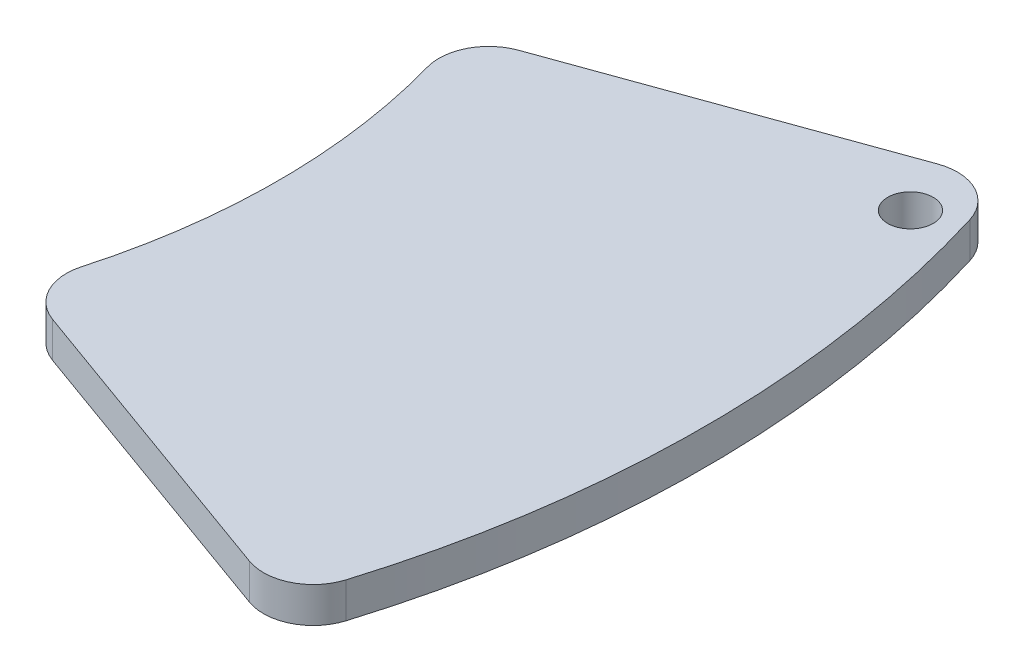
from build123d import *

# Parameters (mm, degrees)
BOSS_EXTRUDE1_DEPTH = 3.175
SKETCH2_R           = 2.032
CUT_EXTRUDE1_DEPTH  = 101.626437428
FILLET1_R           = 4.445


with BuildPart() as part:
    # Sketch1 → Boss-Extrude1 (new body)
    with BuildSketch(Plane(origin=(0, 0, 0), x_dir=(1, 0, 0), z_dir=(0, 1, 0))):
        with BuildLine():
            Line((53.764572514, 19.37764801), (89.607620856, 32.296080017))
            ThreePointArc((89.607620856, 32.296080017), (95.25, 0), (89.607620856, -32.296080017))
            Line((89.607620856, -32.296080017), (53.764572514, -19.37764801))
            ThreePointArc((53.764572514, -19.37764801), (57.15, 0), (53.764572514, 19.37764801))
        make_face()
    extrude(amount=BOSS_EXTRUDE1_DEPTH)

    # Sketch2 → Cut-Extrude1 (cut, through all)
    with BuildSketch(Plane(origin=(0, 3.175, 0), x_dir=(1, 0, 0), z_dir=(0, 1, 0))):
        with Locations(Location((87.702620856, 25.946080017, 0), (0, 0, 270))):
            Circle(SKETCH2_R)
    extrude(amount=-CUT_EXTRUDE1_DEPTH, mode=Mode.SUBTRACT)

    # Fillet1
    fillet1_edges = [part.edges().sort_by_distance(p)[0] for p in [
        (53.764572514, 1.5875, -19.37764801),
        (89.607620856, 1.5875, -32.296080017),
        (89.607620856, 1.5875, 32.296080017),
        (53.764572514, 1.5875, 19.37764801),
    ]]
    fillet(fillet1_edges, radius=FILLET1_R)


solid = part.part
